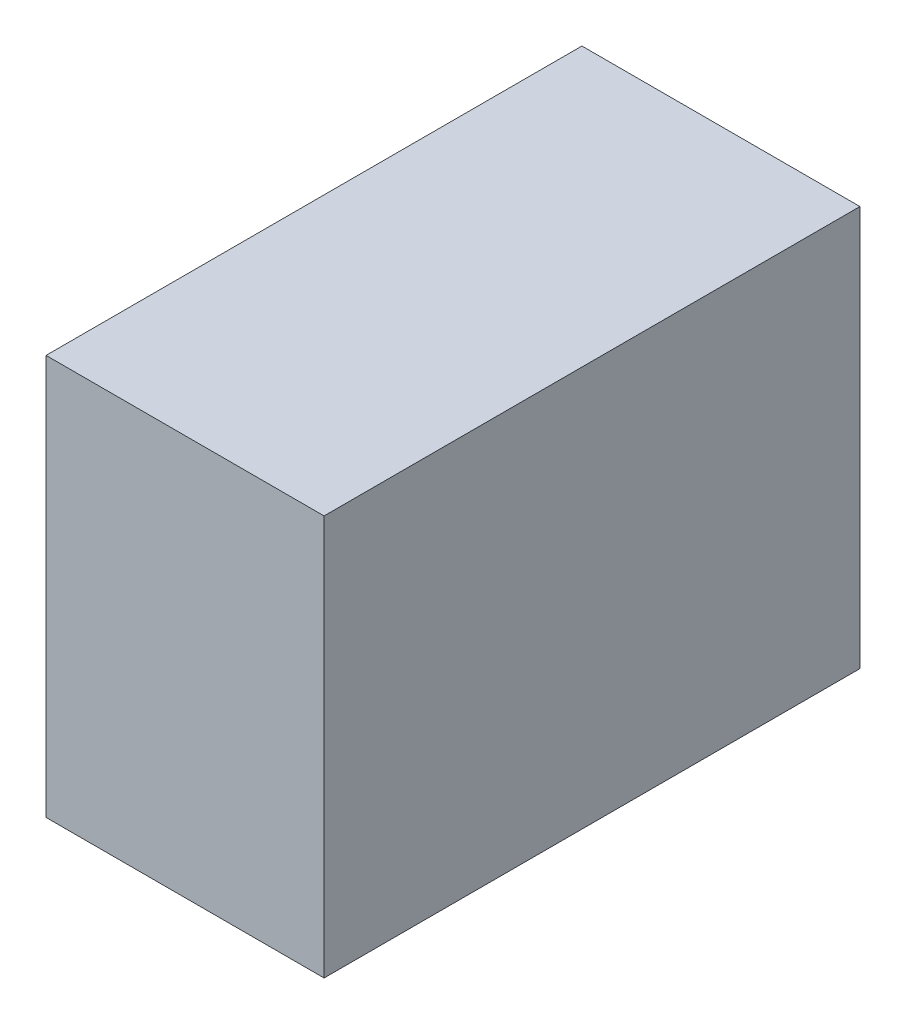
from build123d import *

# Parameters (mm, degrees)
SKETCH1_W      = 97.905228439
SKETCH1_H      = 73.115019589
EXTRUDE1_DEPTH = 50.8


with BuildPart() as part:
    # Sketch1 → Extrude1 (new body)
    with BuildSketch(Plane(origin=(0, 0, 0), x_dir=(0, 0, -1), z_dir=(1, 0, 0))):
        with Locations((48.95261422, 36.557509794)):
            Rectangle(SKETCH1_W, SKETCH1_H)
    extrude(amount=-EXTRUDE1_DEPTH)


solid = part.part
